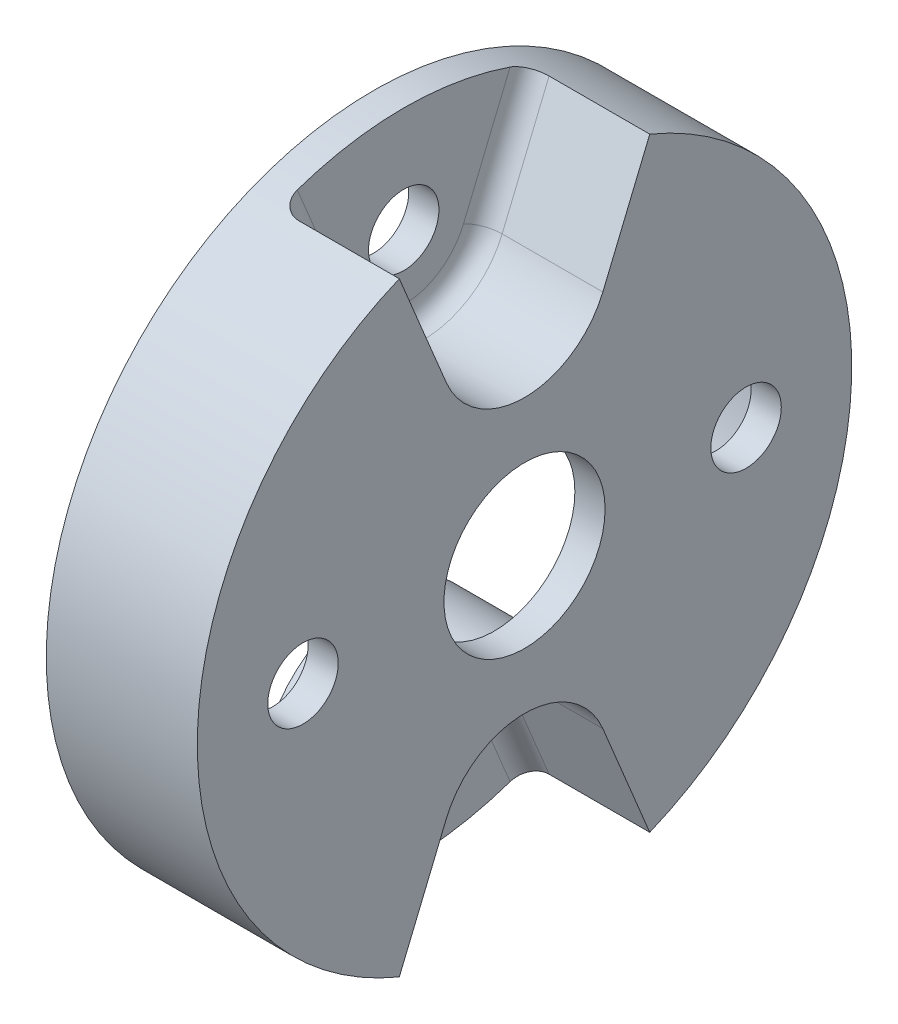
from build123d import *

# Parameters (mm, degrees)
SKETCH1_R           = 32.5
BOSS_EXTRUDE1_DEPTH = 15
CUT_EXTRUDE1_START  = -12
SKETCH2_R           = 3.4999999999999996
CUT_EXTRUDE1_DEPTH  = 12
SKETCH2_3_R         = 3.4999999999999996
SKETCH2_3_R_2       = 3.5
SKETCH2_3_R_3       = 8
CUT_EXTRUDE2_DEPTH  = 49.34769901453429
CUT_EXTRUDE3_START  = -3
SKETCH2_4_R         = 3.5
SKETCH2_4_R_2       = 8
CUT_EXTRUDE3_DEPTH  = 12
FILLET1_R           = 2
FILLET2_R           = 2


with BuildPart() as part:
    # Sketch1 → Boss-Extrude1 (new body)
    with BuildSketch(Plane(origin=(0, 0, 0), x_dir=(0, 0, -1), z_dir=(1, 0, 0))):
        Circle(SKETCH1_R)
    extrude(amount=BOSS_EXTRUDE1_DEPTH)

    # Sketch2 → Cut-Extrude1 (cut)
    # profile 1 of 4: a face of its own
    with BuildSketch(Plane(origin=(15, 0, 0), x_dir=(0, 0, -1), z_dir=(1, 0, 0)).offset(CUT_EXTRUDE1_START)):
        with BuildLine():
            ThreePointArc((12.437211551865326, 30.026084806616858), (1.99e-15, 32.5), (-12.43721155186533, 30.026084806616854))
            Line((-12.437211551865326, 30.02608480661686), (-11.289161254770068, 27.254446209083))
            ThreePointArc((-11.289161254770706, 27.254446209082737), (-1.129e-14, 29.500000000000007), (11.28916125477069, 27.254446209082744))
            Line((11.289161254770068, 27.254446209083), (12.437211551865326, 30.02608480661686))
        make_face()
    # profile 2 of 4: a face of its own
    with BuildSketch(Plane(origin=(15, 0, 0), x_dir=(0, 0, -1), z_dir=(1, 0, 0)).offset(CUT_EXTRUDE1_START)):
        with BuildLine():
            ThreePointArc((11.28916125477069, 27.254446209082744), (-1.129e-14, 29.500000000000007), (-11.289161254770706, 27.254446209082737))
            Line((-11.289161254770068, 27.254446209083), (-7.778174593051978, 18.778174593052064))
            ThreePointArc((-7.778174593051979, 18.778174593052064), (4.4e-16, 13.580964487968082), (7.778174593051979, 18.778174593052064))
            Line((7.778174593051979, 18.778174593052064), (11.289161254770068, 27.254446209083))
        make_face()
        with Locations((0, 22)):
            Circle(SKETCH2_R, mode=Mode.SUBTRACT)
    # profile 3 of 4: a face of its own
    with BuildSketch(Plane(origin=(15, 0, 0), x_dir=(0, 0, -1), z_dir=(1, 0, 0)).offset(CUT_EXTRUDE1_START)):
        with BuildLine():
            Line((-7.778174593051979, -18.778174593052064), (-11.289161254770068, -27.254446209083))
            ThreePointArc((-11.2891612547707, -27.25444620908274), (-5.42e-15, -29.500000000000007), (11.28916125477069, -27.254446209082744))
            Line((11.289161254770068, -27.254446209083), (7.778174593051979, -18.778174593052064))
            ThreePointArc((7.778174593051979, -18.778174593052064), (4.4e-16, -13.580964487968082), (-7.778174593051979, -18.778174593052064))
        make_face()
        with Locations((-1.5363e-13, -22)):
            Circle(SKETCH2_R, mode=Mode.SUBTRACT)
    # profile 4 of 4: a face of its own
    with BuildSketch(Plane(origin=(15, 0, 0), x_dir=(0, 0, -1), z_dir=(1, 0, 0)).offset(CUT_EXTRUDE1_START)):
        with BuildLine():
            Line((-11.289161254770068, -27.254446209083), (-12.437211551865326, -30.02608480661686))
            ThreePointArc((-12.43721155186533, -30.026084806616854), (-5.97e-15, -32.5), (12.43721155186532, -30.02608480661686))
            Line((12.437211551865326, -30.02608480661686), (11.289161254770068, -27.254446209083))
            ThreePointArc((11.28916125477069, -27.254446209082744), (-5.42e-15, -29.500000000000007), (-11.2891612547707, -27.25444620908274))
        make_face()
    extrude(amount=CUT_EXTRUDE1_DEPTH, mode=Mode.SUBTRACT)

    # Sketch2<3> → Cut-Extrude2 (cut, through all)
    with BuildSketch(Plane(origin=(15, 0, 0), x_dir=(0, 0, -1), z_dir=(1, 0, 0))):
        with Locations((0, 22)):
            Circle(SKETCH2_3_R)
        with Locations((-1.5363e-13, -22)):
            Circle(SKETCH2_3_R)
        with Locations((-21.999999999999996, 2.3044e-13)):
            Circle(SKETCH2_3_R_2)
        with Locations((22, -7.681e-14)):
            Circle(SKETCH2_3_R_2)
        Circle(SKETCH2_3_R_3)
    extrude(amount=-CUT_EXTRUDE2_DEPTH, mode=Mode.SUBTRACT)

    # Sketch2<4> → Cut-Extrude3 (cut)
    with BuildSketch(Plane(origin=(15, 0, 0), x_dir=(0, 0, -1), z_dir=(1, 0, 0)).offset(CUT_EXTRUDE3_START)):
        with BuildLine():
            Line((-10.549813190585843, 17.630124295956804), (-14.002272700359098, 25.96509886799544))
            ThreePointArc((-14.002272700359109, 25.965098867995447), (-29.500000000000007, 3.61e-15), (-14.002272700359114, -25.965098867995444))
            Line((-14.0022727003591, -25.96509886799545), (-10.549813190585835, -17.630124295956804))
            ThreePointArc((-10.549813190585837, -17.630124295956804), (1.78e-15, -10.580964487968227), (10.549813190585844, -17.6301242959568))
            Line((10.549813190585843, -17.6301242959568), (14.0022727003591, -25.96509886799545))
            ThreePointArc((14.002272700359107, -25.965098867995447), (25.33097949804344, -15.119241967430227), (29.500000000000007, -7.23e-15))
            ThreePointArc((29.500000000000007, 0), (25.33097949804344, 15.119241967430227), (14.0022727003591, 25.96509886799545))
            Line((14.002272700359098, 25.96509886799544), (10.549813190585843, 17.630124295956804))
            ThreePointArc((10.549813190585843, 17.6301242959568), (-1.78e-15, 10.58096448796808), (-10.549813190585843, 17.630124295956804))
        make_face()
        with Locations((22, -7.681e-14)):
            Circle(SKETCH2_4_R, mode=Mode.SUBTRACT)
        with Locations((-21.999999999999996, 2.3044e-13)):
            Circle(SKETCH2_4_R, mode=Mode.SUBTRACT)
        Circle(SKETCH2_4_R_2, mode=Mode.SUBTRACT)
    extrude(amount=-CUT_EXTRUDE3_DEPTH, mode=Mode.SUBTRACT)

    # Fillet1
    fillet1_edges = [part.edges().sort_by_distance(p)[0] for p in [
        (6, -25.96509886799545, -14.002272700359104),
        (12, -10.580964487968227, -1.78e-15),
        (6, -25.965098867995447, 14.00227270035911),
        (6, 25.965098867995444, 14.002272700359104),
        (12, 21.79761158197612, 12.27604294547247),
        (12, 10.580964487968078, 3.11e-15),
        (12, 21.79761158197612, -12.27604294547247),
        (6, 25.965098867995444, -14.0022727003591),
        (12, 7.11e-15, 29.5),
        (12, -21.797611581976128, 12.276042945472469),
        (12, -21.797611581976128, -12.276042945472472),
        (12, -3.11e-15, -29.500000000000007),
    ]]
    fillet(fillet1_edges, radius=FILLET1_R)

    # Fillet2
    fillet2_edges = [part.edges().sort_by_distance(p)[0] for p in [
        (3, 24.40212969983446, 10.107693072458654),
        (3, 24.402129699834465, -10.107693072458654),
        (3, 13.580964487968082, -8.9e-16),
        (3, -24.40212969983446, 10.107693072458654),
        (3, -13.580964487968082, 8.9e-16),
        (3, -24.402129699834465, -10.107693072458652),
    ]]
    fillet(fillet2_edges, radius=FILLET2_R)


solid = part.part
